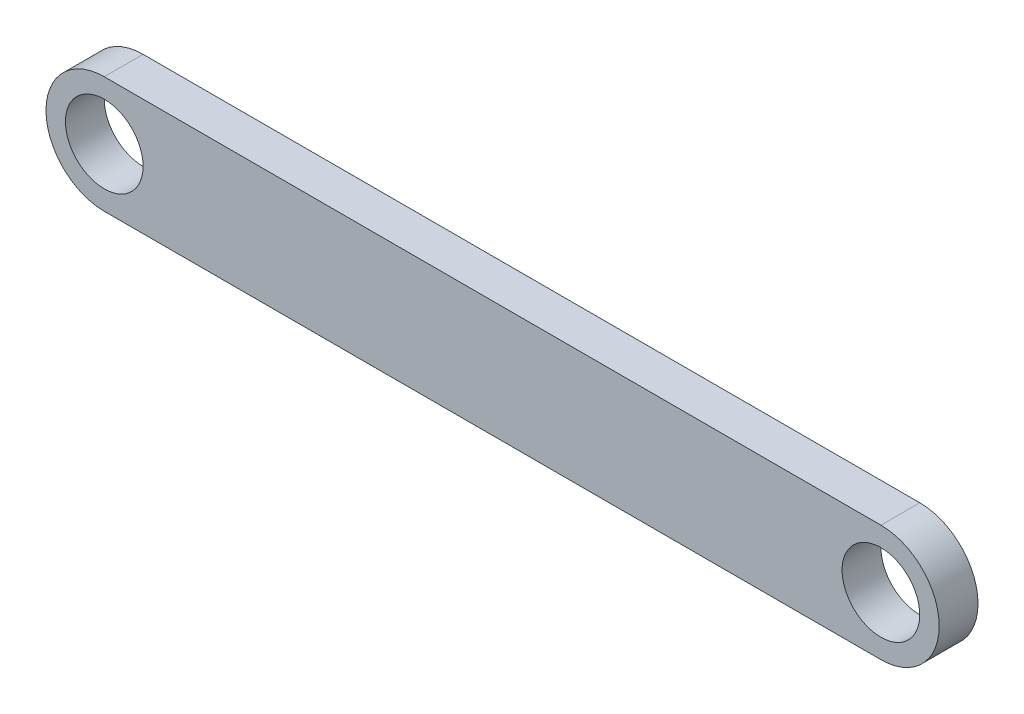
from build123d import *

# Parameters (mm, degrees)
SKETCH1_R           = 10
BOSS_EXTRUDE1_DEPTH = 10


with BuildPart() as part:
    # Sketch1 → Boss-Extrude1 (new body)
    with BuildSketch(Plane.XY):
        with BuildLine():
            Line((-31.80005531, 15), (168.19994469, 15))
            ThreePointArc((168.19994469, 15), (183.19994469, 0), (168.19994469, -15))
            Line((168.19994469, -15), (-31.80005531, -15))
            ThreePointArc((-31.80005531, -15), (-46.80005531, 0), (-31.80005531, 15))
        make_face()
        with Locations((-31.80005531, 0)):
            Circle(SKETCH1_R, mode=Mode.SUBTRACT)
        with Locations((168.19994469, 0)):
            Circle(SKETCH1_R, mode=Mode.SUBTRACT)
    extrude(amount=BOSS_EXTRUDE1_DEPTH)


solid = part.part
